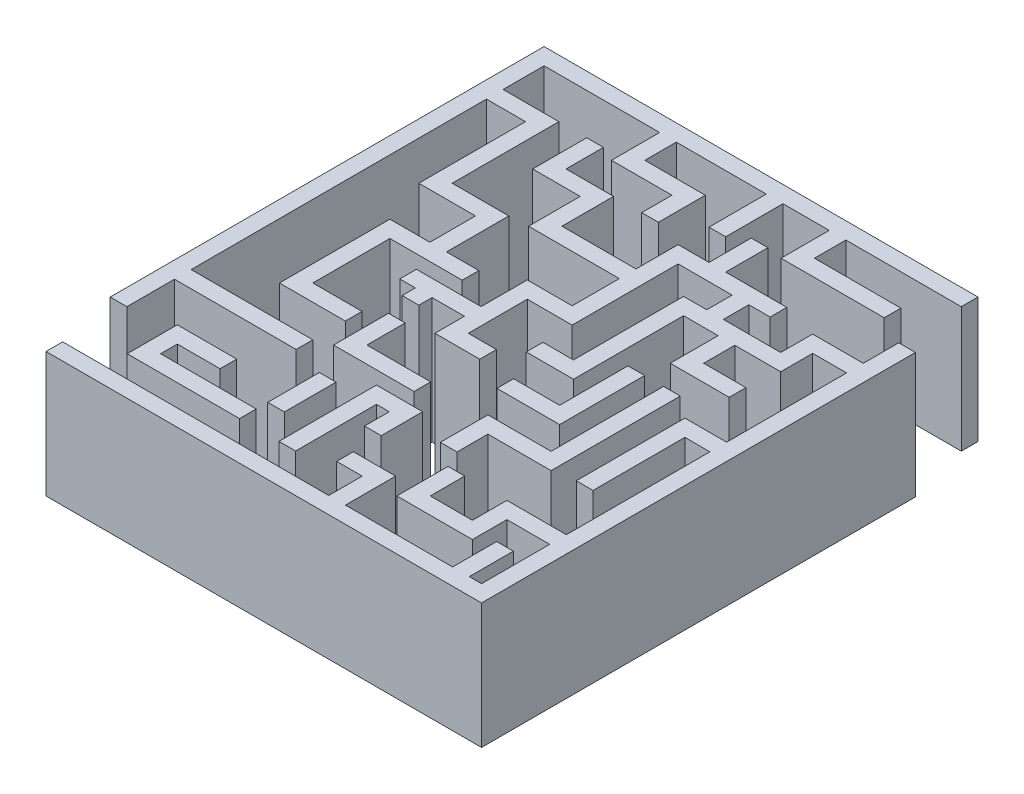
from build123d import *

# Parameters (mm, degrees)
BOSS_EXTRUDE1_DEPTH   = 1500
BOSS_EXTRUDE1_2_DEPTH = 1500
BOSS_EXTRUDE1_3_DEPTH = 1500
SKETCH1_W             = 200
SKETCH1_H             = 618.790113416
BOSS_EXTRUDE1_4_DEPTH = 1500
BOSS_EXTRUDE1_5_DEPTH = 1500
BOSS_EXTRUDE1_6_DEPTH = 1500
BOSS_EXTRUDE1_7_DEPTH = 1500
BOSS_EXTRUDE1_8_DEPTH = 1500


with BuildPart() as part:
    # Sketch1 → Boss-Extrude1 (new body)
    with BuildSketch(Plane(origin=(0, 0, 0), x_dir=(1, 0, 0), z_dir=(0, 1, 0))):
        Polygon((-2480.362214578, 2812.735166706), (-2480.362214578, 2321.64564392), (-1812.242182119, 2321.64564392), (-1812.242182119, 1043.355541206), (-1133.564560671, 1043.355541206), (-1133.564560671, 296.789317438), (-746.102862047, 296.789317438), (-746.102862047, 96.789317438), (-1612.242182119, 96.789317438), (-1612.242182119, -827.188337518), (-1022.305934204, -827.188337518), (-1022.305934204, -1027.188337518), (-1812.242182119, -1027.188337518), (-1812.242182119, 296.789317438), (-1333.564560671, 296.789317438), (-1333.564560671, 843.355541206), (-2012.242182119, 843.355541206), (-2012.242182119, 2121.64564392), (-2480.362214578, 2121.64564392), (-2480.362214578, -1416.859057793), (-1022.305934204, -1416.859057793), (-1022.305934204, -1616.859057793), (-2480.362214578, -1616.859057793), (-2480.362214578, -2187.264833294), (-2680.362214578, -2187.264833294), (-2680.362214578, 3012.735166706), (2519.637785422, 3012.735166706), (2519.637785422, 2812.735166706), (1136.350352087, 2812.735166706), (1136.350352087, 2435.633296391), (2172.749284261, 2435.633296391), (2172.749284261, 2235.633296391), (936.350352087, 2235.633296391), (936.350352087, 2812.735166706), (382.27857764, 2812.735166706), (382.27857764, 2126.238239683), (182.27857764, 2126.238239683), (182.27857764, 2812.735166706), (-896.011525074, 2812.735166706), (-896.011525074, 2435.633296391), (-171.375734363, 2435.633296391), (-171.375734363, 1873.837009211), (-371.375734363, 1873.837009211), (-371.375734363, 2235.633296391), (-1096.011525074, 2235.633296391), (-1096.011525074, 2812.735166706), align=None)
    extrude(amount=BOSS_EXTRUDE1_DEPTH)


with BuildPart() as body_2:
    # Sketch1 → Boss-Extrude1 2 (new body)
    with BuildSketch(Plane(origin=(0, 0, 0), x_dir=(1, 0, 0), z_dir=(0, 1, 0))):
        Polygon((-2499.978238149, -2937.008263822), (688.515824828, -2937.008263822), (688.515824828, -2535.564157051), (382.27857764, -2535.564157051), (382.27857764, -2335.564157051), (888.515824828, -2335.564157051), (888.515824828, -2937.008263822), (2172.749284261, -2937.008263822), (2172.749284261, -2408.84193364), (2372.749284261, -2408.84193364), (2372.749284261, -2937.008263822), (2519.637785422, -2937.008263822), (2519.637785422, -2120.323423048), (2007.124233532, -2120.323423048), (2007.124233532, -2533.953048433), (1101.57337026, -2533.953048433), (1101.57337026, -1920.323423048), (1301.57337026, -1920.323423048), (1301.57337026, -2333.953048433), (1807.124233532, -2333.953048433), (1807.124233532, -1920.323423048), (2519.637785422, -1920.323423048), (2519.637785422, -200), (2219.628189579, -200), (2219.628189579, -1301.533309633), (2019.628189579, -1301.533309633), (2019.628189579, 0), (2519.637785422, 0), (2519.637785422, 1437.719729092), (2112.969910827, 1437.719729092), (2112.969910827, 1055.046895796), (1562.916651679, 1055.046895796), (1562.916651679, 681.715489412), (2068.751993019, 681.715489412), (2068.751993019, 481.715489412), (1362.916651679, 481.715489412), (1362.916651679, 1055.046895796), (948.667460584, 1055.046895796), (948.667460584, -263.953082801), (382.27857764, -263.953082801), (382.27857764, -63.953082801), (748.667460584, -63.953082801), (748.667460584, 1255.046895796), (1026.110916613, 1255.046895796), (1026.110916613, 1559.84935674), (378.729198227, 1559.84935674), (378.729198227, 289.701229202), (-158.641163423, 289.701229202), (-158.641163423, -417.607394805), (178.729198227, -417.607394805), (178.729198227, -617.607394805), (-358.641163423, -617.607394805), (-358.641163423, -263.953082801), (-746.102862047, -263.953082801), (-746.102862047, -422.199990568), (-946.102862047, -422.199990568), (-946.102862047, -263.953082801), (-1133.564560671, -263.953082801), (-1133.564560671, -63.953082801), (-358.641163423, -63.953082801), (-358.641163423, 489.701229202), (178.729198227, 489.701229202), (178.729198227, 1055.046895796), (-908.746096014, 1055.046895796), (-908.746096014, 1673.837009211), (-1478.200775078, 1673.837009211), (-1478.200775078, 2321.64564392), (-1278.200775078, 2321.64564392), (-1278.200775078, 1873.837009211), (-708.746096014, 1873.837009211), (-708.746096014, 1255.046895796), (178.729198227, 1255.046895796), (178.729198227, 1759.84935674), (548.667460584, 1759.84935674), (548.667460584, 2266.164719412), (748.667460584, 2266.164719412), (748.667460584, 1759.84935674), (1481.445226471, 1759.84935674), (1481.445226471, 1559.84935674), (1226.110916613, 1559.84935674), (1226.110916613, 1255.046895796), (1912.969910827, 1255.046895796), (1912.969910827, 1637.719729092), (2519.637785422, 1637.719729092), (2519.637785422, 2062.735166706), (2719.637785422, 2062.735166706), (2719.637785422, -3137.008263822), (-2499.978238149, -3137.008263822), align=None)
    extrude(amount=BOSS_EXTRUDE1_2_DEPTH)


with BuildPart() as body_3:
    # Sketch1 → Boss-Extrude1 3 (new body)
    with BuildSketch(Plane(origin=(0, 0, 0), x_dir=(1, 0, 0), z_dir=(0, 1, 0))):
        Polygon((-1278.200775078, -2073.019426307), (-1990.255984466, -2073.019426307), (-1990.255984466, -2673.816009228), (-644.026604217, -2673.816009228), (-644.026604217, -2473.816009228), (-1790.255984466, -2473.816009228), (-1790.255984466, -2273.019426307), (-1278.200775078, -2273.019426307), align=None)
    extrude(amount=BOSS_EXTRUDE1_3_DEPTH)


with BuildPart() as body_4:
    # Sketch1 → Boss-Extrude1 4 (new body)
    with BuildSketch(Plane(origin=(0, 0, 0), x_dir=(1, 0, 0), z_dir=(0, 1, 0))):
        with Locations((-544.026604217, -2026.169100343)):
            Rectangle(SKETCH1_W, SKETCH1_H)
    extrude(amount=BOSS_EXTRUDE1_4_DEPTH)


with BuildPart() as body_5:
    # Sketch1 → Boss-Extrude1 5 (new body)
    with BuildSketch(Plane(origin=(0, 0, 0), x_dir=(1, 0, 0), z_dir=(0, 1, 0))):
        Polygon((-171.375734363, -2673.816009228), (-171.375734363, -1505.082689046), (382.27857764, -1505.082689046), (382.27857764, -2001.743174813), (182.27857764, -2001.743174813), (182.27857764, -1705.082689046), (28.624265637, -1705.082689046), (28.624265637, -2673.816009228), align=None)
    extrude(amount=BOSS_EXTRUDE1_5_DEPTH)


with BuildPart() as body_6:
    # Sketch1 → Boss-Extrude1 6 (new body)
    with BuildSketch(Plane(origin=(0, 0, 0), x_dir=(1, 0, 0), z_dir=(0, 1, 0))):
        Polygon((1562.916651679, 200.966502149), (1562.916651679, -1146.835781279), (805.66128682, -1146.835781279), (805.66128682, -1716.774043635), (1005.66128682, -1716.774043635), (1005.66128682, -1346.835781279), (1762.916651679, -1346.835781279), (1762.916651679, 200.966502149), align=None)
    extrude(amount=BOSS_EXTRUDE1_6_DEPTH)


with BuildPart() as body_7:
    # Sketch1 → Boss-Extrude1 7 (new body)
    with BuildSketch(Plane(origin=(0, 0, 0), x_dir=(1, 0, 0), z_dir=(0, 1, 0))):
        Polygon((1136.350352087, 200.966502149), (1136.350352087, -617.607394805), (584.586384409, -617.607394805), (584.586384409, -817.607394805), (1336.350352087, -817.607394805), (1336.350352087, 200.966502149), align=None)
    extrude(amount=BOSS_EXTRUDE1_7_DEPTH)


with BuildPart() as body_8:
    # Sketch1 → Boss-Extrude1 8 (new body)
    with BuildSketch(Plane(origin=(0, 0, 0), x_dir=(1, 0, 0), z_dir=(0, 1, 0))):
        Polygon((-644.026604217, -688.419124288), (-644.026604217, -1146.835781279), (120.669689889, -1146.835781279), (120.669689889, -1346.835781279), (-844.026604217, -1346.835781279), (-844.026604217, -688.419124288), align=None)
    extrude(amount=BOSS_EXTRUDE1_8_DEPTH)


solid = Compound([part.part, body_2.part, body_3.part, body_4.part, body_5.part, body_6.part, body_7.part, body_8.part])
